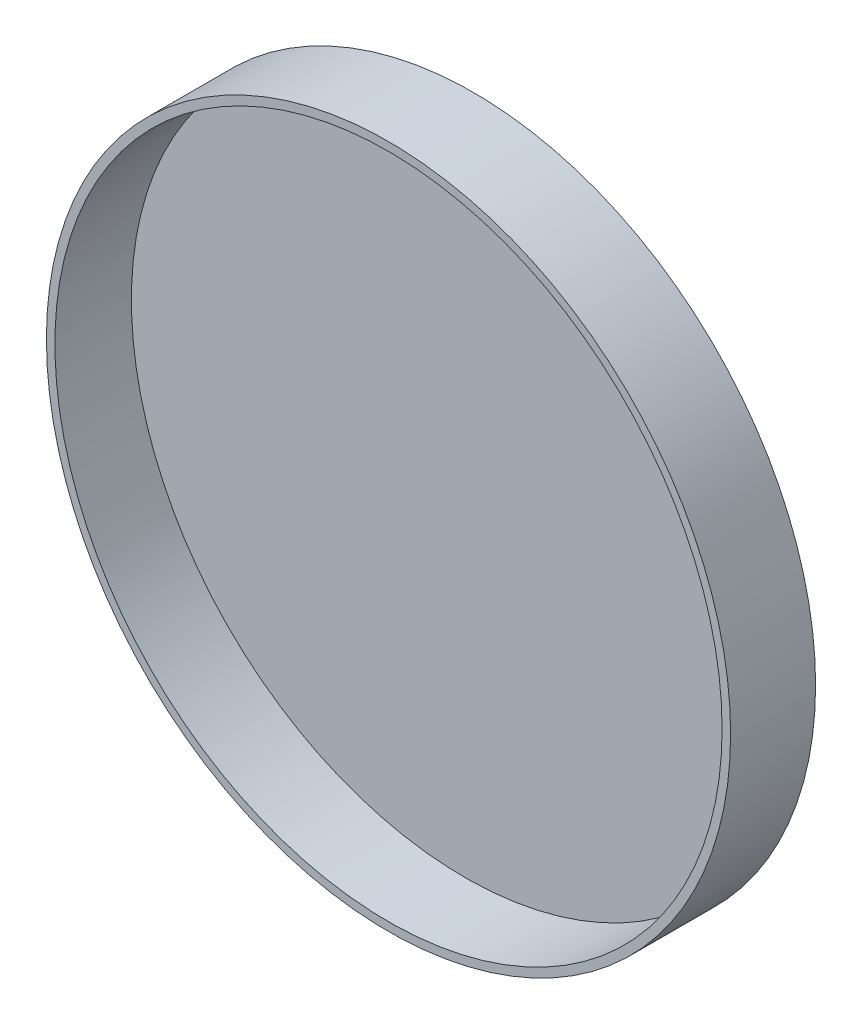
from build123d import *

# Parameters (mm, degrees)
ESQUISSE1_R        = 40.25
BOSS_EXTRU_1_DEPTH = 1
ESQUISSE2_R        = 40.25
ESQUISSE2_R_2      = 39.25
BOSS_EXTRU_2_DEPTH = 9


with BuildPart() as part:
    # Esquisse1 → Boss.-Extru.1 (new body)
    with BuildSketch(Plane.XY):
        Circle(ESQUISSE1_R)
    extrude(amount=BOSS_EXTRU_1_DEPTH)

    # Esquisse2 → Boss.-Extru.2 (add)
    with BuildSketch(Plane.XY.offset(1)):
        Circle(ESQUISSE2_R)
        Circle(ESQUISSE2_R_2, mode=Mode.SUBTRACT)
    extrude(amount=BOSS_EXTRU_2_DEPTH)


solid = part.part
